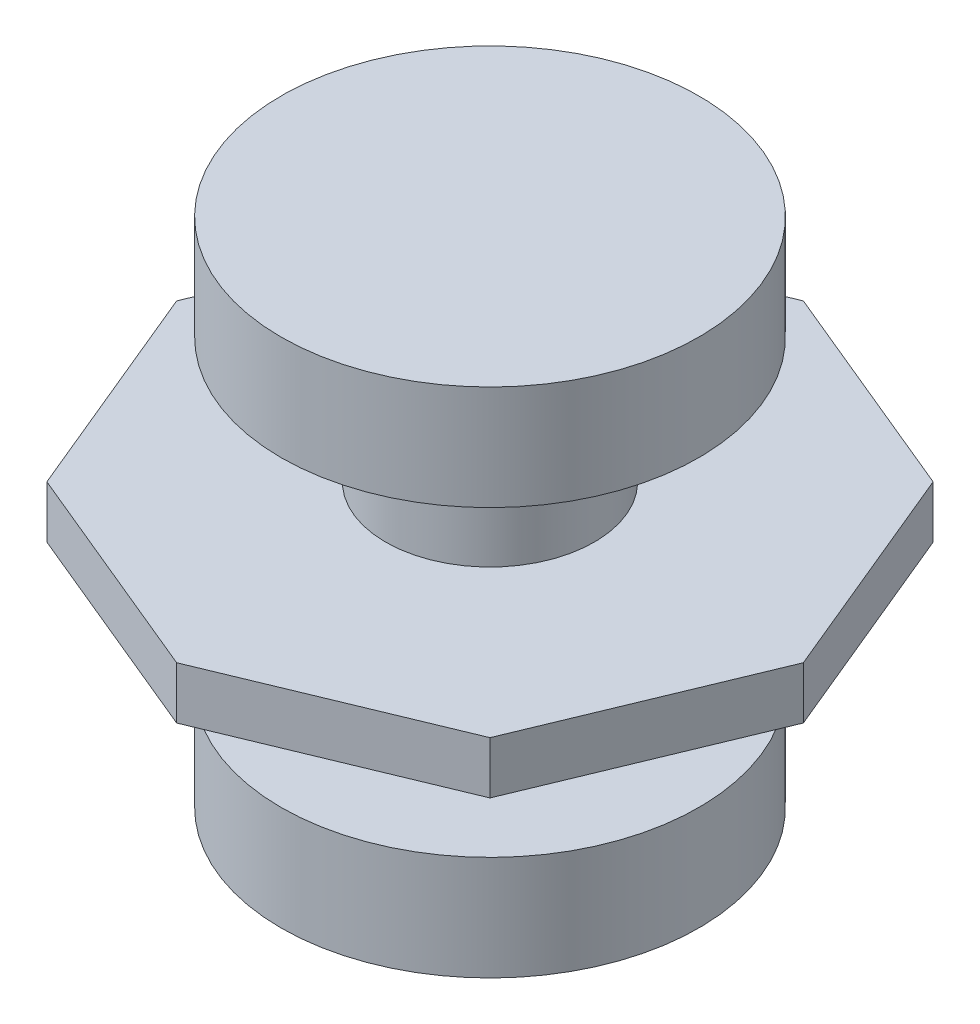
from build123d import *

# Parameters (mm, degrees)
SKETCH2_R           = 20
BOSS_EXTRUDE1_DEPTH = 10
SKETCH3_R           = 10
BOSS_EXTRUDE2_DEPTH = 12
BOSS_EXTRUDE3_DEPTH = 5
SKETCH5_R           = 10
BOSS_EXTRUDE4_DEPTH = 12
SKETCH6_R           = 20
BOSS_EXTRUDE5_DEPTH = 10


with BuildPart() as part:
    # Sketch2 → Boss-Extrude1 (new body)
    with BuildSketch(Plane(origin=(0, 0, 0), x_dir=(1, 0, 0), z_dir=(0, 1, 0))):
        with Locations(Location((0, 0, 0), (0, 0, 270))):
            Circle(SKETCH2_R)
    extrude(amount=BOSS_EXTRUDE1_DEPTH)

    # Sketch3 → Boss-Extrude2 (add)
    with BuildSketch(Plane(origin=(0, 10, 0), x_dir=(1, 0, 0), z_dir=(0, 1, 0))):
        with Locations(Location((0, 0, 0), (0, 0, 270))):
            Circle(SKETCH3_R)
    extrude(amount=BOSS_EXTRUDE2_DEPTH)

    # Sketch4 → Boss-Extrude3 (add)
    with BuildSketch(Plane(origin=(0, 22, 0), x_dir=(1, 0, 0), z_dir=(0, 1, 0))):
        Polygon((30, 0), (21.213203436, 21.213203436), (0, 30), (-21.213203436, 21.213203436), (-30, 0), (-21.213203436, -21.213203436), (0, -30), (21.213203436, -21.213203436), align=None)
    extrude(amount=BOSS_EXTRUDE3_DEPTH)

    # Sketch5 → Boss-Extrude4 (add)
    with BuildSketch(Plane(origin=(0, 27, 0), x_dir=(1, 0, 0), z_dir=(0, 1, 0))):
        with Locations(Location((0, 0, 0), (0, 0, 270))):
            Circle(SKETCH5_R)
    extrude(amount=BOSS_EXTRUDE4_DEPTH)

    # Sketch6 → Boss-Extrude5 (add)
    with BuildSketch(Plane(origin=(0, 39, 0), x_dir=(1, 0, 0), z_dir=(0, 1, 0))):
        with Locations(Location((0, 0, 0), (0, 0, 270))):
            Circle(SKETCH6_R)
    extrude(amount=BOSS_EXTRUDE5_DEPTH)


solid = part.part
